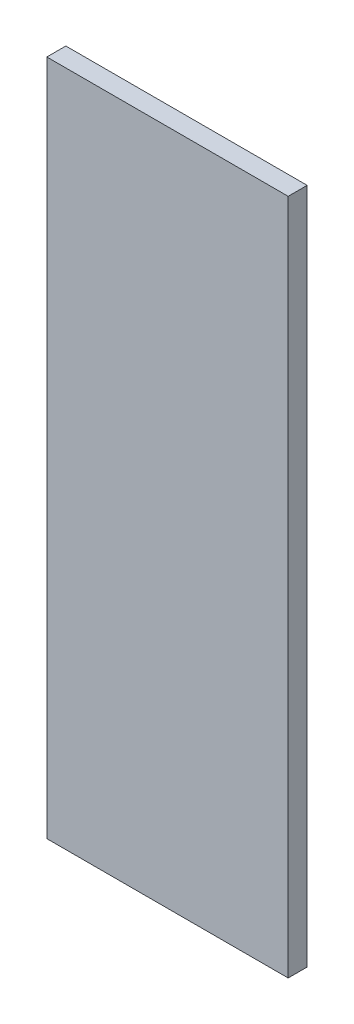
from build123d import *

# Parameters (mm, degrees)
SKETCH1_W           = 20.32
SKETCH1_H           = 57
BOSS_EXTRUDE1_DEPTH = 1.6
SKETCH2_W           = 8.416880896
SKETCH2_H           = 4
BOSS_EXTRUDE2_DEPTH = 6


with BuildPart() as part:
    # Sketch1 → Boss-Extrude1 (new body)
    with BuildSketch(Plane.XY):
        with Locations((10.16, 28.5)):
            Rectangle(SKETCH1_W, SKETCH1_H)
    extrude(amount=BOSS_EXTRUDE1_DEPTH)

    # Sketch2 → Boss-Extrude2 (add)
    with BuildSketch(Plane.XY.offset(1.6)):
        with Locations((10.891541536, 2)):
            Rectangle(SKETCH2_W, SKETCH2_H)
    extrude(amount=-BOSS_EXTRUDE2_DEPTH)


solid = part.part
